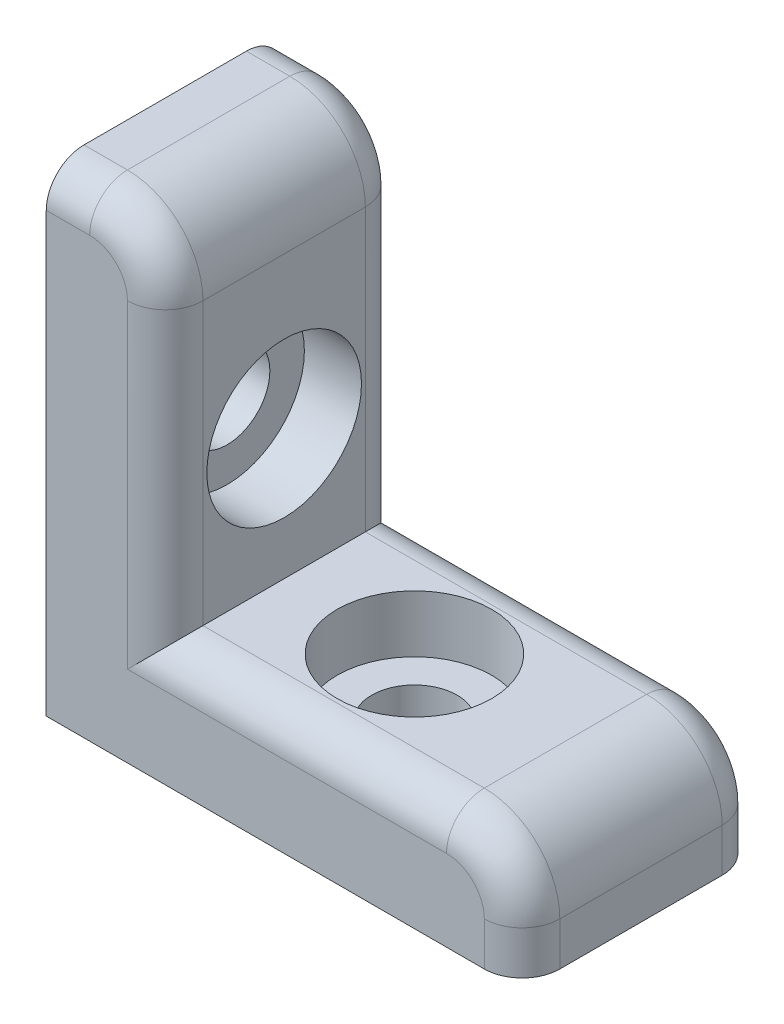
from build123d import *

# Parameters (mm, degrees)
BOSS_EXTRUDE1_DEPTH                                  = 5
CBORE_FOR_M3_HEX_SOCKET_THIN_HEAD_CAP_SC_D           = 3.6
CBORE_FOR_M3_HEX_SOCKET_THIN_HEAD_CAP_SC_CBORE_D     = 6.5
CBORE_FOR_M3_HEX_SOCKET_THIN_HEAD_CAP_SC_CBORE_DEPTH = 2.4
CBORE_FOR_M3_HEX_SOCKET_THIN_HEAD_CA_2_D             = 3.6
CBORE_FOR_M3_HEX_SOCKET_THIN_HEAD_CA_2_CBORE_D       = 6.5
CBORE_FOR_M3_HEX_SOCKET_THIN_HEAD_CA_2_CBORE_DEPTH   = 2.4
FILLET1_R                                            = 3.175
FILLET2_R                                            = 1.5875


with BuildPart() as part:
    # Sketch1 → Boss-Extrude1 (new, symmetric)
    with BuildSketch(Plane.XY):
        Polygon((0, 0), (20, 0), (20, 5), (5, 5), (5, 20), (0, 20), align=None)
    extrude(amount=BOSS_EXTRUDE1_DEPTH, both=True)

    # CBORE for M3 Hex Socket Thin Head Cap Sc (through all)
    with Locations(Plane(origin=(5, 0, 0), x_dir=(0, 0, -1), z_dir=(1, 0, 0))):
        with Locations((0, 10.475)):
            CounterBoreHole(CBORE_FOR_M3_HEX_SOCKET_THIN_HEAD_CAP_SC_D / 2, CBORE_FOR_M3_HEX_SOCKET_THIN_HEAD_CAP_SC_CBORE_D / 2, CBORE_FOR_M3_HEX_SOCKET_THIN_HEAD_CAP_SC_CBORE_DEPTH)

    # CBORE for M3 Hex Socket Thin Head Ca 2 (through all)
    with Locations(Plane(origin=(0, 5, 0), x_dir=(1, 0, 0), z_dir=(0, 1, 0))):
        with Locations((10.475, 0)):
            CounterBoreHole(CBORE_FOR_M3_HEX_SOCKET_THIN_HEAD_CA_2_D / 2, CBORE_FOR_M3_HEX_SOCKET_THIN_HEAD_CA_2_CBORE_D / 2, CBORE_FOR_M3_HEX_SOCKET_THIN_HEAD_CA_2_CBORE_DEPTH)

    # Fillet1
    fillet1_edges = [part.edges().sort_by_distance(p)[0] for p in [
        (5, 20, 0),
        (20, 5, 0),
    ]]
    fillet(fillet1_edges, radius=FILLET1_R)

    # Fillet2
    fillet2_edges = [part.edges().sort_by_distance(p)[0] for p in [
        (20, 0.9125, 5),
        (5, 10.9125, 5),
        (10.9125, 5, -5),
        (10.9125, 5, 5),
        (0.9125, 20, -5),
        (4.07006403, 19.07006403, -5),
        (19.07006403, 4.07006403, -5),
        (0.9125, 20, 5),
        (4.07006403, 19.07006403, 5),
        (19.07006403, 4.07006403, 5),
        (5, 10.9125, -5),
        (20, 0.9125, -5),
    ]]
    fillet(fillet2_edges, radius=FILLET2_R)


solid = part.part
